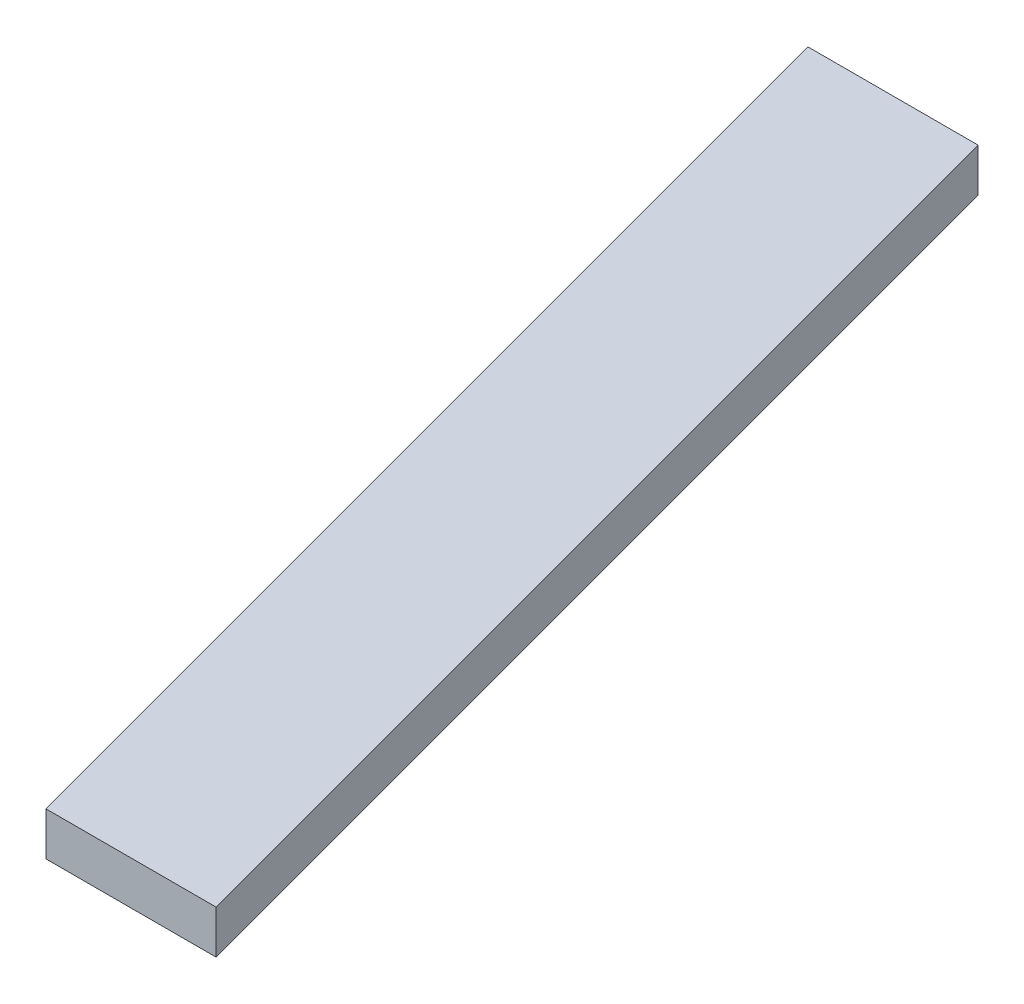
from build123d import *

# Parameters (mm, degrees)
BOSS_EXTRUDE1_DEPTH = 3.175


with BuildPart() as part:
    # Sketch2 → Boss-Extrude1 (new body)
    with BuildSketch(Plane(origin=(0, 0, 0), x_dir=(1, 0, 0), z_dir=(0, 1, 0))):
        Polygon((0, 0), (12.446, 0), (32.863728463, -76.2), (20.417728463, -76.2), align=None)
    extrude(amount=BOSS_EXTRUDE1_DEPTH)


solid = part.part
